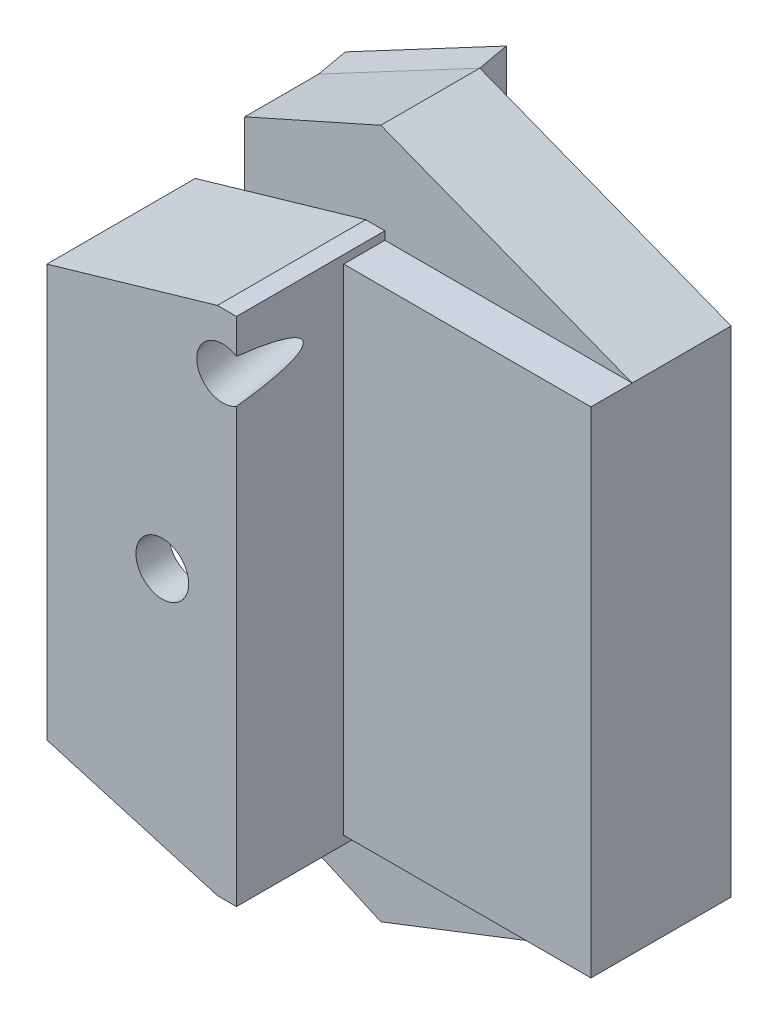
from build123d import *

# Parameters (mm, degrees)
SKETCH_1_W          = 11.5
SKETCH_1_H          = 9
EXTRUDE_1_DEPTH     = 15.5
CUT_EXTRUDE_1_REACH = 21.904
CUT_EXTRUDE_3_DEPTH = 10
SKETCH_7_R          = 1.6
CUT_EXTRUDE_4_DEPTH = 3.2
SKETCH_9_W          = 15
SKETCH_9_H          = 2.5
EXTRUDE_2_DEPTH     = 15
EXTRUDE_3_DEPTH     = 6
CUT_EXTRUDE_5_DEPTH = 25
SKETCH_12_R         = 1.55
CUT_EXTRUDE_6_DEPTH = 50
EXTRUDE_4_DEPTH     = 2


with BuildPart() as part:
    # 草图1 → 凸台-拉伸1 (new, symmetric)
    with BuildSketch(Plane(origin=(0, 0, 0), x_dir=(1, 0, 0), z_dir=(0, 1, 0))):
        with Locations((2.905437314, 1.868632411)):
            Rectangle(SKETCH_1_W, SKETCH_1_H)
    extrude(amount=EXTRUDE_1_DEPTH, both=True)

    # 草图3 → 切除-拉伸1 (cut, up to next)
    with BuildSketch(Plane.XY.offset(2.631367589), mode=Mode.PRIVATE) as cut_extrude_1_sk1:
        Polygon((-2.844562686, 15.5), (-2.844562686, 12.5), (7.496374606, 15.5), align=None)
    cut_extrude_1_tool1 = extrude(cut_extrude_1_sk1.sketch, amount=-CUT_EXTRUDE_1_REACH, mode=Mode.PRIVATE) & part.part
    # 草图3 → 切除-拉伸1 (cut, up to next)
    with BuildSketch(Plane.XY.offset(2.631367589), mode=Mode.PRIVATE) as cut_extrude_1_sk2:
        Polygon((7.496374606, -15.5), (-2.844562686, -15.5), (-2.844562686, -12.5), align=None)
    cut_extrude_1_tool2 = extrude(cut_extrude_1_sk2.sketch, amount=-CUT_EXTRUDE_1_REACH, mode=Mode.PRIVATE) & part.part
    add(cut_extrude_1_tool1.solids().sort_by_distance((0.602416, 14.5, 2.631368))[0], mode=Mode.SUBTRACT)
    add(cut_extrude_1_tool2.solids().sort_by_distance((0.602416, -14.5, 2.631368))[0], mode=Mode.SUBTRACT)

    # 草图6 → 切除-拉伸3 (cut)
    with BuildSketch(Plane.ZY.offset(2.844562686)):
        Polygon((0.631367589, 9.665706569), (-6.368632411, 9.665706569), (-11.26294246, 9.665706569), (-11.26294246, -9.665706569), (-6.368632411, -9.665706569), (0.631367589, -9.665706569), align=None)
    extrude(amount=-CUT_EXTRUDE_3_DEPTH, mode=Mode.SUBTRACT)

    # 草图7 → 切除-拉伸4 (cut)
    with BuildSketch(Plane(origin=(0, 0, 0.631367589), x_dir=(-1, 0, 0), z_dir=(0, 0, -1))):
        with Locations(Location((-4.155437314, 0, 0), (0, 0, 90))):
            Circle(SKETCH_7_R)
    extrude(amount=-CUT_EXTRUDE_4_DEPTH, mode=Mode.SUBTRACT)

    # 草图9 → 凸台-拉伸2 (add, symmetric)
    with BuildSketch(Plane(origin=(0, 0, 0), x_dir=(1, 0, 0), z_dir=(0, 1, 0))):
        with Locations((16.155437314, 5.118632411)):
            Rectangle(SKETCH_9_W, SKETCH_9_H)
    extrude(amount=EXTRUDE_2_DEPTH, both=True)

    # 草图10 → 凸台-拉伸3 (add)
    with BuildSketch(Plane(origin=(0, 0, -6.368632411), x_dir=(-1, 0, 0), z_dir=(0, 0, -1))):
        Polygon((2.844562686, 9.665706569), (2.844562686, 15.89839332), (-8.411310933, 20.920270748), (-23.655437314, 15), (-23.655437314, -15), (-8.411310933, -20.920270748), (2.844562686, -15.89839332), (2.844562686, -9.665706569), (-7.155437314, -9.665706569), (-7.155437314, 9.665706569), align=None)
    extrude(amount=EXTRUDE_3_DEPTH)

    # 草图11 → 切除-拉伸5 (cut, symmetric)
    with BuildSketch(Plane(origin=(0, 0, 0), x_dir=(1, 0, 0), z_dir=(0, 1, 0))):
        Polygon((8.411310933, 12.368632411), (0.155437314, 10.860086612), (0.155437314, 6.368632411), (-2.844562686, 6.368632411), (-2.844562686, 10.368632411), (-2.844562686, 12.368632411), align=None)
    extrude(amount=CUT_EXTRUDE_5_DEPTH, both=True, mode=Mode.SUBTRACT)

    # 草图12 → 切除-拉伸6 (cut)
    with BuildSketch(Plane(origin=(-1.915261303, 0, -10.481720391), x_dir=(-0.9837127141080302, 0, 0.17974786814372187), z_dir=(-0.17974786814372187, 0, -0.9837127141080303))):
        with Locations((-7.219941257, 12.090668535)):
            Circle(SKETCH_12_R)
    extrude(amount=-CUT_EXTRUDE_6_DEPTH, mode=Mode.SUBTRACT)

    # 草图13 → 凸台-拉伸4 (add)
    with BuildSketch(Plane(origin=(-1.915261303, 0, -10.481720391), x_dir=(-0.9837127141080303, 0, 0.17974786814372185), z_dir=(-0.17974786814372182, 0, -0.9837127141080302))):
        Polygon((-10.497548815, 20.920270748), (-10.497548815, 16.920270748), (-2.104983078, 16.920270748), (-2.104983078, 17.23686182), align=None)
        Polygon((-10.497548815, -20.920270748), (-10.497548815, -16.920270748), (-2.104983078, -16.920270748), (-2.104983078, -17.23686182), align=None)
    extrude(amount=EXTRUDE_4_DEPTH)


solid = part.part
